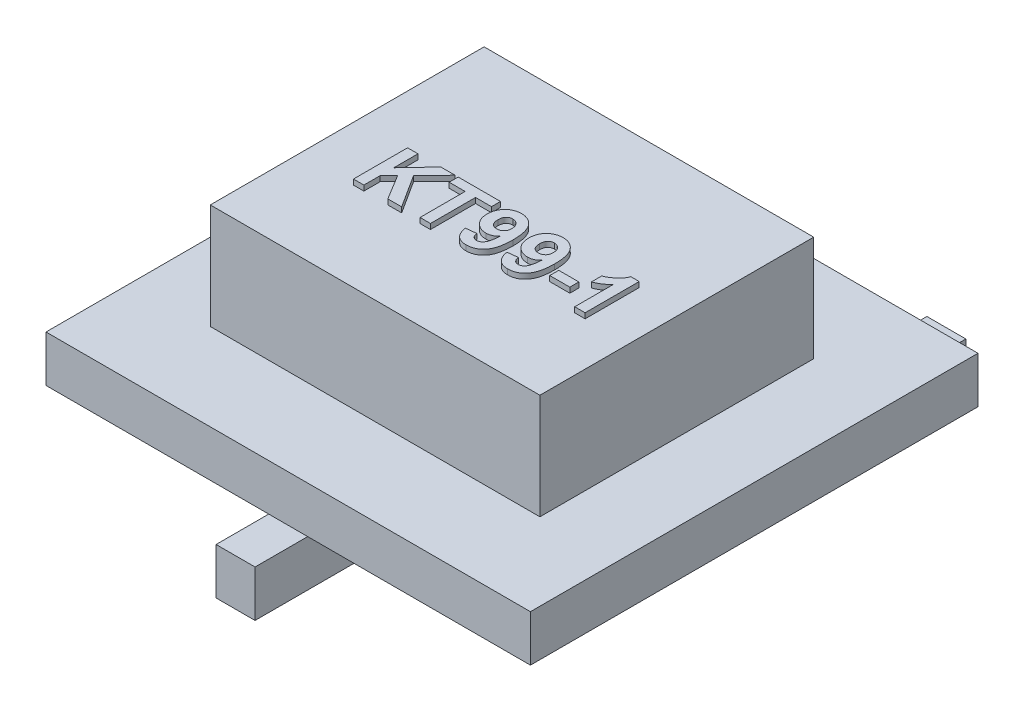
from build123d import *

# Parameters (mm, degrees)
SKETCH_1_W      = 4.6
SKETCH_1_H      = 4.25
EXTRUDE_1_DEPTH = 0.44
SKETCH_2_W      = 3.13
SKETCH_2_H      = 2.6
EXTRUDE_2_DEPTH = 1
SKETCH_3_W      = 0.190977543
SKETCH_3_H      = 0.085610623
EXTRUDE_3_DEPTH = 0.05
EXTRUDE_4_DEPTH = 0.44


with BuildPart() as part:
    # Эскиз1 → Бобышка-Вытянуть1 (new body)
    with BuildSketch(Plane(origin=(0, 0, 0), x_dir=(1, 0, 0), z_dir=(0, 1, 0))):
        with Locations((-3.296969697, 2.788636364)):
            Rectangle(SKETCH_1_W, SKETCH_1_H)
    extrude(amount=EXTRUDE_1_DEPTH)

    # Эскиз2 → Бобышка-Вытянуть2 (add)
    with BuildSketch(Plane(origin=(0, 0.44, 0), x_dir=(1, 0, 0), z_dir=(0, 1, 0))):
        with Locations((-3.296969697, 2.788636364)):
            Rectangle(SKETCH_2_W, SKETCH_2_H)
    extrude(amount=EXTRUDE_2_DEPTH)

    # Эскиз3 → Бобышка-Вытянуть3 (add)
    # profile 1 of 6: a face of its own
    with BuildSketch(Plane(origin=(0, 1.44, 0), x_dir=(1, 0, 0), z_dir=(0, 1, 0))):
        Polygon((-4.344984679, 2.331307053), (-4.344984679, 2.84497079), (-4.246203191, 2.84497079), (-4.246203191, 2.614995139), (-4.029604199, 2.84497079), (-3.893882551, 2.84497079), (-4.088975989, 2.64637884), (-3.887297118, 2.331307053), (-4.018902871, 2.331307053), (-4.163885284, 2.569926085), (-4.246203191, 2.486167615), (-4.246203191, 2.331307053), align=None)
    # profile 2 of 6: a face of its own
    with BuildSketch(Plane(origin=(0, 1.44, 0), x_dir=(1, 0, 0), z_dir=(0, 1, 0))):
        Polygon((-3.712783156, 2.331307053), (-3.712783156, 2.759360167), (-3.864248105, 2.759360167), (-3.864248105, 2.84497079), (-3.46253672, 2.84497079), (-3.46253672, 2.759360167), (-3.614001669, 2.759360167), (-3.614001669, 2.331307053), align=None)
    # profile 3 of 6: a face of its own
    with BuildSketch(Plane(origin=(0, 1.44, 0), x_dir=(1, 0, 0), z_dir=(0, 1, 0))):
        with BuildLine():
            Line((-3.40985326, 2.458694013), (-3.311071772, 2.469601136))
            add(Edge.make_bspline(
                [(-3.311071772, 2.469601136), (-3.310424946, 2.464871774), (-3.30920231, 2.455932308), (-3.305292812, 2.443665417), (-3.300392829, 2.433135707), (-3.29373406, 2.424662163), (-3.285787547, 2.418194473), (-3.276686292, 2.413527466), (-3.266393973, 2.410839138), (-3.259158837, 2.41050542), (-3.255404288, 2.410332243)],
                knots=[0, 0, 0, 0, 1.261142327, 2.383817955, 3.394783384, 4.319218401, 5.209639591, 6.086630953, 7.00709008, 8, 8, 8, 8], degree=3))
            add(Edge.make_bspline(
                [(-3.255404288, 2.410332243), (-3.252960186, 2.410388892), (-3.248129942, 2.410500846), (-3.24106388, 2.412079206), (-3.23422612, 2.414291959), (-3.22768714, 2.417530563), (-3.221509453, 2.421698606), (-3.215539872, 2.426702002), (-3.209961505, 2.432701153), (-3.204420552, 2.43958709), (-3.199405098, 2.448046161), (-3.194978676, 2.458306125), (-3.190845842, 2.470364138), (-3.187450949, 2.484370159), (-3.184395223, 2.500203477), (-3.181736904, 2.517914764), (-3.179580171, 2.537514843), (-3.178626924, 2.551228833), (-3.178128353, 2.558401578)],
                knots=[0, 0, 0, 0, 0.636702566, 1.258306339, 1.881198412, 2.509855161, 3.155497192, 3.822694, 4.538353708, 5.290656154, 6.125969777, 7.095962945, 8.203044623, 9.449504243, 10.854253673, 12.411741228, 14.12325476, 16, 16, 16, 16], degree=3))
            add(Edge.make_bspline(
                [(-3.178128353, 2.558401578), (-3.181288473, 2.555009779), (-3.187519109, 2.548322357), (-3.197838467, 2.539548723), (-3.208825923, 2.532172391), (-3.220425266, 2.526226809), (-3.232515488, 2.521369246), (-3.245295361, 2.518174029), (-3.258586943, 2.515981792), (-3.267674166, 2.515794222), (-3.272279459, 2.515699164)],
                knots=[0, 0, 0, 0, 1.041520616, 2.053509057, 3.037255372, 4.009786987, 4.979165048, 5.959157055, 6.965725879, 8, 8, 8, 8], degree=3))
            add(Edge.make_bspline(
                [(-3.272279459, 2.515699164), (-3.277327933, 2.51584395), (-3.287295722, 2.516129819), (-3.301959781, 2.518205973), (-3.316088646, 2.521746341), (-3.329704874, 2.52665587), (-3.342739633, 2.533163198), (-3.355359128, 2.540835187), (-3.367292561, 2.550121653), (-3.378714051, 2.560498116), (-3.388985271, 2.572179793), (-3.398158323, 2.584705747), (-3.405920577, 2.598144872), (-3.41218151, 2.612482883), (-3.417023648, 2.627628517), (-3.420544066, 2.643569055), (-3.422601011, 2.660387559), (-3.42288116, 2.671891745), (-3.423024125, 2.677762542)],
                knots=[0, 0, 0, 0, 0.980269742, 1.935460739, 2.869230488, 3.804804075, 4.740187949, 5.694100724, 6.667990488, 7.67211685, 8.68661751, 9.683203946, 10.682901945, 11.694007529, 12.71565541, 13.766145059, 14.860022949, 16, 16, 16, 16], degree=3))
            add(Edge.make_bspline(
                [(-3.423024125, 2.677762542), (-3.42289403, 2.683875007), (-3.42263884, 2.695865047), (-3.420400053, 2.713345428), (-3.416980943, 2.729985213), (-3.411875603, 2.745636944), (-3.405522745, 2.760468723), (-3.397626676, 2.774294548), (-3.388448973, 2.787306723), (-3.377724422, 2.799118319), (-3.366066647, 2.809930686), (-3.353490704, 2.819339858), (-3.340069552, 2.827203255), (-3.325922094, 2.833738019), (-3.310942201, 2.838770745), (-3.295225612, 2.842357163), (-3.278757044, 2.844580931), (-3.267519015, 2.84483906), (-3.261783926, 2.84497079)],
                knots=[0, 0, 0, 0, 1.1238417, 2.204496613, 3.236450213, 4.243990082, 5.227299393, 6.199188572, 7.167261658, 8.150145869, 9.127934804, 10.088143708, 11.032722787, 11.984040773, 12.949643861, 13.93368149, 14.945498424, 16, 16, 16, 16], degree=3))
            add(Edge.make_bspline(
                [(-3.261783926, 2.84497079), (-3.255531589, 2.844798033), (-3.243271493, 2.844459276), (-3.225302959, 2.8416384), (-3.208253688, 2.836838981), (-3.191954272, 2.830403041), (-3.176639647, 2.821828796), (-3.162110575, 2.811480464), (-3.148561177, 2.799146776), (-3.135754229, 2.785071983), (-3.124102054, 2.768808662), (-3.114181374, 2.75001248), (-3.105742745, 2.728861412), (-3.098931377, 2.705310034), (-3.093609091, 2.679364386), (-3.089935713, 2.651024966), (-3.087477706, 2.62028616), (-3.087273159, 2.598982664), (-3.087167067, 2.587933127)],
                knots=[0, 0, 0, 0, 0.854852685, 1.67626545, 2.479841517, 3.273455256, 4.067207639, 4.874322592, 5.708061326, 6.568303409, 7.473035808, 8.43640186, 9.467839227, 10.582672616, 11.785182758, 13.086903962, 14.489057258, 16, 16, 16, 16], degree=3))
            add(Edge.make_bspline(
                [(-3.087167067, 2.587933127), (-3.087320408, 2.576712644), (-3.087616669, 2.555034205), (-3.090007091, 2.523738478), (-3.093790692, 2.494841734), (-3.099353611, 2.468395604), (-3.106334694, 2.444304993), (-3.115113006, 2.422661671), (-3.125336839, 2.403354013), (-3.137305189, 2.3865598), (-3.150462737, 2.371963738), (-3.164604589, 2.359318578), (-3.179751015, 2.348662451), (-3.195770576, 2.339773848), (-3.212902799, 2.333117543), (-3.230910609, 2.328295182), (-3.249842446, 2.325171313), (-3.262800441, 2.324873341), (-3.269398332, 2.324721621)],
                knots=[0, 0, 0, 0, 1.487495966, 2.873904204, 4.158892752, 5.348685137, 6.453750751, 7.479786756, 8.440129076, 9.343583348, 10.206541379, 11.040779453, 11.853317241, 12.65721927, 13.463689683, 14.283322899, 15.125910407, 16, 16, 16, 16], degree=3))
            add(Edge.make_bspline(
                [(-3.269398332, 2.324721621), (-3.274135529, 2.32481911), (-3.28343013, 2.32501039), (-3.297038076, 2.326549245), (-3.30995031, 2.329223278), (-3.322123854, 2.332957704), (-3.333653718, 2.337549891), (-3.344442015, 2.343375847), (-3.354491555, 2.350302405), (-3.363973459, 2.358116679), (-3.372506817, 2.367174726), (-3.380356491, 2.377175477), (-3.387398167, 2.388219001), (-3.393395352, 2.400400224), (-3.398931346, 2.413436556), (-3.403390823, 2.427616938), (-3.407110115, 2.442781358), (-3.40892273, 2.453296121), (-3.40985326, 2.458694013)],
                knots=[0, 0, 0, 0, 1.056675019, 2.073245589, 3.050223185, 3.994251036, 4.910773036, 5.814621688, 6.723026041, 7.630269412, 8.550362125, 9.493303905, 10.463425011, 11.466105649, 12.519144845, 13.620215273, 14.778306119, 16, 16, 16, 16], degree=3))
        make_face()
        with BuildLine():
            add(Edge.make_bspline(
                [(-3.185948554, 2.675293005), (-3.185984938, 2.67855544), (-3.18605565, 2.684895982), (-3.18725818, 2.69407818), (-3.189002961, 2.702676785), (-3.191313775, 2.710787185), (-3.194540076, 2.718275291), (-3.198366812, 2.725259017), (-3.202888549, 2.731682363), (-3.209849481, 2.73918623), (-3.219298344, 2.747263403), (-3.231956048, 2.754279293), (-3.245551253, 2.758653732), (-3.254960366, 2.75912266), (-3.259725978, 2.759360167)],
                knots=[0, 0, 0, 0, 0.937516427, 1.822063352, 2.657744432, 3.45986214, 4.242145632, 4.997087526, 5.746986504, 6.494090859, 7.936347984, 9.300605415, 10.632786197, 12, 12, 12, 12], degree=3))
            add(Edge.make_bspline(
                [(-3.259725978, 2.759360167), (-3.264174389, 2.759158467), (-3.272832739, 2.758765879), (-3.28522473, 2.755237468), (-3.296450601, 2.74951075), (-3.304627492, 2.742829763), (-3.310454727, 2.736457477), (-3.314106977, 2.730749345), (-3.317216811, 2.724386813), (-3.319791517, 2.717315632), (-3.321823124, 2.709531971), (-3.323263551, 2.700994318), (-3.324047652, 2.691771425), (-3.324176332, 2.68537837), (-3.324242637, 2.682084232)],
                knots=[0, 0, 0, 0, 1.397188569, 2.719475933, 4.017809812, 5.337496372, 6.01771949, 6.727108146, 7.460709441, 8.242571956, 9.09066939, 9.98839818, 10.963485712, 12, 12, 12, 12], degree=3))
            add(Edge.make_bspline(
                [(-3.324242637, 2.682084232), (-3.324189573, 2.678720214), (-3.324087016, 2.672218695), (-3.323124986, 2.662799801), (-3.321681779, 2.654060405), (-3.319337439, 2.646068741), (-3.316583016, 2.638711046), (-3.313256871, 2.631964951), (-3.309033007, 2.62607966), (-3.302931436, 2.619099056), (-3.294004553, 2.611993269), (-3.281900729, 2.60579736), (-3.268529516, 2.601966927), (-3.259168399, 2.601532316), (-3.254375314, 2.601309787)],
                knots=[0, 0, 0, 0, 1.000122719, 1.932902026, 2.813346472, 3.630219284, 4.405058741, 5.14865055, 5.858963796, 6.55275156, 7.902081098, 9.220520156, 10.576848858, 12, 12, 12, 12], degree=3))
            add(Edge.make_bspline(
                [(-3.254375314, 2.601309787), (-3.249717361, 2.601492299), (-3.240628511, 2.601848428), (-3.22769756, 2.605652161), (-3.215826901, 2.611486662), (-3.20714217, 2.618372622), (-3.200933699, 2.624894679), (-3.196937804, 2.630495654), (-3.193493041, 2.636625815), (-3.190742078, 2.643339612), (-3.188578511, 2.650578737), (-3.187055024, 2.658331362), (-3.18610886, 2.666626148), (-3.186003163, 2.672340607), (-3.185948554, 2.675293005)],
                knots=[0, 0, 0, 0, 1.470045212, 2.868431389, 4.227473852, 5.634383908, 6.348475288, 7.071419378, 7.805118666, 8.569021284, 9.362200428, 10.192314795, 11.06605236, 12, 12, 12, 12], degree=3))
        make_face(mode=Mode.SUBTRACT)
    # profile 4 of 6: a face of its own
    with BuildSketch(Plane(origin=(0, 1.44, 0), x_dir=(1, 0, 0), z_dir=(0, 1, 0))):
        with BuildLine():
            Line((-3.014727309, 2.458694013), (-2.915945821, 2.469601136))
            add(Edge.make_bspline(
                [(-2.915945821, 2.469601136), (-2.915298994, 2.464871774), (-2.914076359, 2.455932308), (-2.91016686, 2.443665417), (-2.905266877, 2.433135707), (-2.898608108, 2.424662163), (-2.890661596, 2.418194473), (-2.88156034, 2.413527466), (-2.871268021, 2.410839138), (-2.864032886, 2.41050542), (-2.860278337, 2.410332243)],
                knots=[0, 0, 0, 0, 1.261142327, 2.383817955, 3.394783384, 4.319218401, 5.209639591, 6.086630953, 7.00709008, 8, 8, 8, 8], degree=3))
            add(Edge.make_bspline(
                [(-2.860278337, 2.410332243), (-2.857834235, 2.410388892), (-2.853003991, 2.410500846), (-2.845937929, 2.412079206), (-2.839100169, 2.414291959), (-2.832561188, 2.417530563), (-2.826383501, 2.421698606), (-2.82041392, 2.426702002), (-2.814835553, 2.432701153), (-2.809294601, 2.43958709), (-2.804279146, 2.448046161), (-2.799852725, 2.458306125), (-2.795719891, 2.470364138), (-2.792324998, 2.484370159), (-2.789269272, 2.500203477), (-2.786610953, 2.517914764), (-2.784454219, 2.537514843), (-2.783500973, 2.551228833), (-2.783002402, 2.558401578)],
                knots=[0, 0, 0, 0, 0.636702566, 1.258306339, 1.881198412, 2.509855161, 3.155497192, 3.822694, 4.538353708, 5.290656154, 6.125969777, 7.095962945, 8.203044623, 9.449504243, 10.854253673, 12.411741228, 14.12325476, 16, 16, 16, 16], degree=3))
            add(Edge.make_bspline(
                [(-2.783002402, 2.558401578), (-2.786162522, 2.555009779), (-2.792393158, 2.548322357), (-2.802712515, 2.539548723), (-2.813699971, 2.532172391), (-2.825299314, 2.526226809), (-2.837389536, 2.521369246), (-2.85016941, 2.518174029), (-2.863460992, 2.515981792), (-2.872548215, 2.515794222), (-2.877153507, 2.515699164)],
                knots=[0, 0, 0, 0, 1.041520616, 2.053509057, 3.037255372, 4.009786987, 4.979165048, 5.959157055, 6.965725879, 8, 8, 8, 8], degree=3))
            add(Edge.make_bspline(
                [(-2.877153507, 2.515699164), (-2.882201981, 2.51584395), (-2.892169771, 2.516129819), (-2.906833829, 2.518205973), (-2.920962694, 2.521746341), (-2.934578923, 2.52665587), (-2.947613681, 2.533163198), (-2.960233177, 2.540835187), (-2.97216661, 2.550121653), (-2.983588099, 2.560498116), (-2.993859319, 2.572179793), (-3.003032372, 2.584705747), (-3.010794625, 2.598144872), (-3.017055559, 2.612482883), (-3.021897696, 2.627628517), (-3.025418114, 2.643569055), (-3.027475059, 2.660387559), (-3.027755209, 2.671891745), (-3.027898174, 2.677762542)],
                knots=[0, 0, 0, 0, 0.980269742, 1.935460739, 2.869230488, 3.804804075, 4.740187949, 5.694100724, 6.667990488, 7.67211685, 8.68661751, 9.683203946, 10.682901945, 11.694007529, 12.71565541, 13.766145059, 14.860022949, 16, 16, 16, 16], degree=3))
            add(Edge.make_bspline(
                [(-3.027898174, 2.677762542), (-3.027768079, 2.683875007), (-3.027512888, 2.695865047), (-3.025274102, 2.713345428), (-3.021854992, 2.729985213), (-3.016749651, 2.745636944), (-3.010396794, 2.760468723), (-3.002500725, 2.774294548), (-2.993323021, 2.787306723), (-2.98259847, 2.799118319), (-2.970940695, 2.809930686), (-2.958364753, 2.819339858), (-2.9449436, 2.827203255), (-2.930796142, 2.833738019), (-2.915816249, 2.838770745), (-2.900099661, 2.842357163), (-2.883631093, 2.844580931), (-2.872393063, 2.84483906), (-2.866657974, 2.84497079)],
                knots=[0, 0, 0, 0, 1.1238417, 2.204496613, 3.236450213, 4.243990082, 5.227299393, 6.199188572, 7.167261658, 8.150145869, 9.127934804, 10.088143708, 11.032722787, 11.984040773, 12.949643861, 13.93368149, 14.945498424, 16, 16, 16, 16], degree=3))
            add(Edge.make_bspline(
                [(-2.866657974, 2.84497079), (-2.860405638, 2.844798033), (-2.848145542, 2.844459276), (-2.830177007, 2.8416384), (-2.813127736, 2.836838981), (-2.79682832, 2.830403041), (-2.781513696, 2.821828796), (-2.766984624, 2.811480464), (-2.753435226, 2.799146776), (-2.740628278, 2.785071983), (-2.728976103, 2.768808662), (-2.719055423, 2.75001248), (-2.710616794, 2.728861412), (-2.703805425, 2.705310034), (-2.69848314, 2.679364386), (-2.694809762, 2.651024966), (-2.692351754, 2.62028616), (-2.692147208, 2.598982664), (-2.692041115, 2.587933127)],
                knots=[0, 0, 0, 0, 0.854852685, 1.67626545, 2.479841517, 3.273455256, 4.067207639, 4.874322592, 5.708061326, 6.568303409, 7.473035808, 8.43640186, 9.467839227, 10.582672616, 11.785182758, 13.086903962, 14.489057258, 16, 16, 16, 16], degree=3))
            add(Edge.make_bspline(
                [(-2.692041115, 2.587933127), (-2.692194456, 2.576712644), (-2.692490717, 2.555034205), (-2.694881139, 2.523738478), (-2.698664741, 2.494841734), (-2.70422766, 2.468395604), (-2.711208743, 2.444304993), (-2.719987055, 2.422661671), (-2.730210887, 2.403354013), (-2.742179238, 2.3865598), (-2.755336786, 2.371963738), (-2.769478637, 2.359318578), (-2.784625063, 2.348662451), (-2.800644624, 2.339773848), (-2.817776848, 2.333117543), (-2.835784657, 2.328295182), (-2.854716494, 2.325171313), (-2.867674489, 2.324873341), (-2.874272381, 2.324721621)],
                knots=[0, 0, 0, 0, 1.487495966, 2.873904204, 4.158892752, 5.348685137, 6.453750751, 7.479786756, 8.440129076, 9.343583348, 10.206541379, 11.040779453, 11.853317241, 12.65721927, 13.463689683, 14.283322899, 15.125910407, 16, 16, 16, 16], degree=3))
            add(Edge.make_bspline(
                [(-2.874272381, 2.324721621), (-2.879009578, 2.32481911), (-2.888304179, 2.32501039), (-2.901912124, 2.326549245), (-2.914824358, 2.329223278), (-2.926997903, 2.332957704), (-2.938527767, 2.337549891), (-2.949316064, 2.343375847), (-2.959365604, 2.350302405), (-2.968847508, 2.358116679), (-2.977380866, 2.367174726), (-2.98523054, 2.377175477), (-2.992272215, 2.388219001), (-2.998269401, 2.400400224), (-3.003805395, 2.413436556), (-3.008264871, 2.427616938), (-3.011984163, 2.442781358), (-3.013796779, 2.453296121), (-3.014727309, 2.458694013)],
                knots=[0, 0, 0, 0, 1.056675019, 2.073245589, 3.050223185, 3.994251036, 4.910773036, 5.814621688, 6.723026041, 7.630269412, 8.550362125, 9.493303905, 10.463425011, 11.466105649, 12.519144845, 13.620215273, 14.778306119, 16, 16, 16, 16], degree=3))
        make_face()
        with BuildLine():
            add(Edge.make_bspline(
                [(-2.790822603, 2.675293005), (-2.790858987, 2.67855544), (-2.790929699, 2.684895982), (-2.792132229, 2.69407818), (-2.79387701, 2.702676785), (-2.796187824, 2.710787185), (-2.799414125, 2.718275291), (-2.80324086, 2.725259017), (-2.807762598, 2.731682363), (-2.81472353, 2.73918623), (-2.824172393, 2.747263403), (-2.836830097, 2.754279293), (-2.850425301, 2.758653732), (-2.859834414, 2.75912266), (-2.864600027, 2.759360167)],
                knots=[0, 0, 0, 0, 0.937516427, 1.822063352, 2.657744432, 3.45986214, 4.242145632, 4.997087526, 5.746986504, 6.494090859, 7.936347984, 9.300605415, 10.632786197, 12, 12, 12, 12], degree=3))
            add(Edge.make_bspline(
                [(-2.864600027, 2.759360167), (-2.869048438, 2.759158467), (-2.877706788, 2.758765879), (-2.890098778, 2.755237468), (-2.901324649, 2.74951075), (-2.909501541, 2.742829763), (-2.915328775, 2.736457477), (-2.918981025, 2.730749345), (-2.922090859, 2.724386813), (-2.924665566, 2.717315632), (-2.926697173, 2.709531971), (-2.9281376, 2.700994318), (-2.9289217, 2.691771425), (-2.929050381, 2.68537837), (-2.929116686, 2.682084232)],
                knots=[0, 0, 0, 0, 1.397188569, 2.719475933, 4.017809812, 5.337496372, 6.01771949, 6.727108146, 7.460709441, 8.242571956, 9.09066939, 9.98839818, 10.963485712, 12, 12, 12, 12], degree=3))
            add(Edge.make_bspline(
                [(-2.929116686, 2.682084232), (-2.929063621, 2.678720214), (-2.928961065, 2.672218695), (-2.927999035, 2.662799801), (-2.926555828, 2.654060405), (-2.924211487, 2.646068741), (-2.921457064, 2.638711046), (-2.91813092, 2.631964951), (-2.913907056, 2.62607966), (-2.907805485, 2.619099056), (-2.898878601, 2.611993269), (-2.886774778, 2.60579736), (-2.873403565, 2.601966927), (-2.864042448, 2.601532316), (-2.859249363, 2.601309787)],
                knots=[0, 0, 0, 0, 1.000122719, 1.932902026, 2.813346472, 3.630219284, 4.405058741, 5.14865055, 5.858963796, 6.55275156, 7.902081098, 9.220520156, 10.576848858, 12, 12, 12, 12], degree=3))
            add(Edge.make_bspline(
                [(-2.859249363, 2.601309787), (-2.854591409, 2.601492299), (-2.84550256, 2.601848428), (-2.832571608, 2.605652161), (-2.820700949, 2.611486662), (-2.812016219, 2.618372622), (-2.805807748, 2.624894679), (-2.801811852, 2.630495654), (-2.79836709, 2.636625815), (-2.795616126, 2.643339612), (-2.793452559, 2.650578737), (-2.791929072, 2.658331362), (-2.790982908, 2.666626148), (-2.790877212, 2.672340607), (-2.790822603, 2.675293005)],
                knots=[0, 0, 0, 0, 1.470045212, 2.868431389, 4.227473852, 5.634383908, 6.348475288, 7.071419378, 7.805118666, 8.569021284, 9.362200428, 10.192314795, 11.06605236, 12, 12, 12, 12], degree=3))
        make_face(mode=Mode.SUBTRACT)
    # profile 5 of 6: a face of its own
    with BuildSketch(Plane(origin=(0, 1.44, 0), x_dir=(1, 0, 0), z_dir=(0, 1, 0))):
        with Locations((-2.524112586, 2.512406448)):
            Rectangle(SKETCH_3_W, SKETCH_3_H)
    # profile 6 of 6: a face of its own
    with BuildSketch(Plane(origin=(0, 1.44, 0), x_dir=(1, 0, 0), z_dir=(0, 1, 0))):
        with BuildLine():
            Line((-2.145450215, 2.331307053), (-2.244231703, 2.331307053))
            Line((-2.244231703, 2.331307053), (-2.244231703, 2.697004353))
            add(Edge.make_bspline(
                [(-2.244231703, 2.697004353), (-2.248709011, 2.69245905), (-2.257602887, 2.683430107), (-2.271807808, 2.670835936), (-2.286554681, 2.659120035), (-2.301989441, 2.648393686), (-2.317910316, 2.638504056), (-2.334480008, 2.629529179), (-2.351578414, 2.621344874), (-2.36342322, 2.616771119), (-2.369354921, 2.614480652)],
                knots=[0, 0, 0, 0, 1.012567276, 2.011397996, 3.011400399, 4.000747768, 4.993445519, 5.985067596, 6.990952157, 8, 8, 8, 8], degree=3))
            Line((-2.369354921, 2.614480652), (-2.369354921, 2.71326214))
            add(Edge.make_bspline(
                [(-2.369354921, 2.71326214), (-2.362776366, 2.715728815), (-2.349007963, 2.720891376), (-2.32869043, 2.731872404), (-2.307483513, 2.745468024), (-2.289668493, 2.758802179), (-2.2755241, 2.770657308), (-2.265638244, 2.780186972), (-2.25647843, 2.789945842), (-2.248388957, 2.800248899), (-2.241157473, 2.810887838), (-2.234750063, 2.821845278), (-2.229110069, 2.833155833), (-2.226157572, 2.841032252), (-2.2246812, 2.84497079)],
                knots=[0, 0, 0, 0, 1.253673617, 2.623841347, 4.114270668, 5.751233548, 6.594491912, 7.409089316, 8.202422231, 8.983165545, 9.746111525, 10.498431446, 11.249153235, 12, 12, 12, 12], degree=3))
            Line((-2.2246812, 2.84497079), (-2.145450215, 2.84497079))
            Line((-2.145450215, 2.84497079), (-2.145450215, 2.331307053))
        make_face()
    extrude(amount=EXTRUDE_3_DEPTH)

    # Эскиз4 → Бобышка-Вытянуть4 (add)
    with BuildSketch(Plane.XZ):
        Polygon((-1.981969697, -5.413636364), (-1.981969697, -4.288636364), (-1.796969697, -4.288636364), (-1.611969697, -4.288636364), (-1.611969697, -5.413636364), align=None)
        Polygon((-3.481969697, -1.644190799), (-3.481969697, -0.163636364), (-3.111969697, -0.163636364), (-3.111969697, -1.644190799), (-1.865504451, -1.644190799), (-1.865504451, -3.933081929), (-3.111969697, -3.933081929), (-3.111969697, -5.413636364), (-3.481969697, -5.413636364), (-3.481969697, -3.933081929), (-4.728434943, -3.933081929), (-4.728434943, -1.644190799), align=None)
        Polygon((-4.981969697, -5.413636364), (-4.981969697, -4.288636364), (-4.796969697, -4.288636364), (-4.611969697, -4.288636364), (-4.611969697, -5.413636364), align=None)
    extrude(amount=EXTRUDE_4_DEPTH)


solid = part.part
